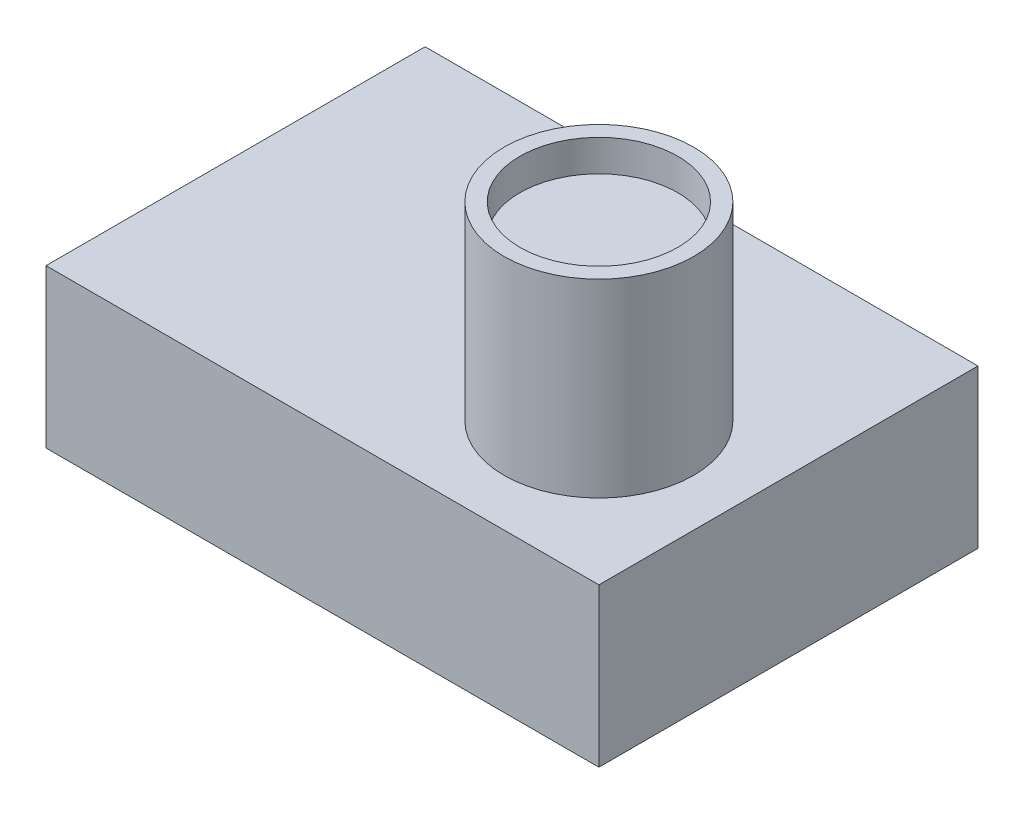
from build123d import *

# Parameters (mm, degrees)
SKETCH2_W           = 35
SKETCH2_H           = 24
BOSS_EXTRUDE1_DEPTH = 10
SKETCH3_R           = 6
BOSS_EXTRUDE2_DEPTH = 12
SKETCH4_R           = 5
CUT_EXTRUDE2_DEPTH  = 2


with BuildPart() as part:
    # Sketch2 → Boss-Extrude1 (new body)
    with BuildSketch(Plane(origin=(0, 0, 0), x_dir=(1, 0, 0), z_dir=(0, 1, 0))):
        Rectangle(SKETCH2_W, SKETCH2_H)
    extrude(amount=BOSS_EXTRUDE1_DEPTH)

    # Sketch3 → Boss-Extrude2 (add)
    with BuildSketch(Plane(origin=(0, 10, 0), x_dir=(1, 0, 0), z_dir=(0, 1, 0))):
        with Locations(Location((8.5, -3, 0), (0, 0, 270))):
            Circle(SKETCH3_R)
    extrude(amount=BOSS_EXTRUDE2_DEPTH)

    # Sketch4 → Cut-Extrude2 (cut)
    with BuildSketch(Plane(origin=(0, 22, 0), x_dir=(1, 0, 0), z_dir=(0, 1, 0))):
        with Locations(Location((8.5, -3, 0), (0, 0, 270))):
            Circle(SKETCH4_R)
    extrude(amount=-CUT_EXTRUDE2_DEPTH, mode=Mode.SUBTRACT)


solid = part.part
